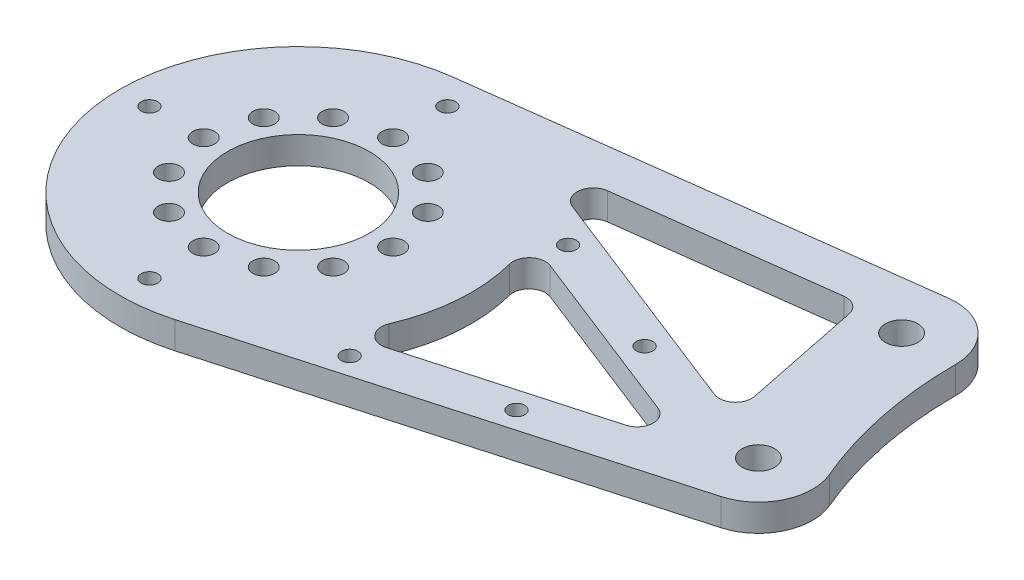
from build123d import *

# Parameters (mm, degrees)
SKETCH_1_R          = 33
SKETCH_1_R_2        = 13.1
SKETCH_1_R_3        = 2.025
SKETCH_1_R_4        = 10
SKETCH_1_R_5        = 3
EXTRUDE_1_DEPTH     = 5
CUT_EXTRUDE_3_DEPTH = 10
FILLET_2_R          = 3
SKETCH_5_R          = 1.525
CUT_EXTRUDE_4_DEPTH = 20


with BuildPart() as part:
    # 草图1 → 凸台-拉伸1 (new body)
    # profile 1 of 4: a face of its own
    with BuildSketch(Plane(origin=(0, 0, 0), x_dir=(1, 0, 0), z_dir=(0, 1, 0))):
        with BuildLine():
            ThreePointArc((33, 0), (26.302762101, -19.928991592), (8.929411765, -31.768940894))
            Line((8.929411765, -31.768940894), (87.705882353, -9.626951786))
            ThreePointArc((87.705882353, -9.626951786), (75.985476525, 4.328783491), (94.205048973, 3.907310252))
            ThreePointArc((94.205048973, 3.907310252), (89.748559809, 18.25955029), (88.242912543, 33.212145922))
            ThreePointArc((88.242912543, 33.212145922), (71.63638997, 25.705225149), (76.972140647, 43.13107423))
            Line((76.972140647, 43.13107423), (-4.193547259, 32.732463418))
            ThreePointArc((-4.193547259, 32.732463418), (21.801524493, 24.772838549), (33, 0))
        make_face()
    # profile 2 of 4: a face of its own
    with BuildSketch(Plane(origin=(0, 0, 0), x_dir=(1, 0, 0), z_dir=(0, 1, 0))):
        Circle(SKETCH_1_R)
        with Locations(Location((0, 0, 0), (0, 0, 270))):
            Circle(SKETCH_1_R_2, mode=Mode.SUBTRACT)
        with Locations(Location((0, 17.5, 0), (0, 0, 270))):
            Circle(SKETCH_1_R_3, mode=Mode.SUBTRACT)
        with Locations(Location((8.75, 15.155444566, 0), (0, 0, 270))):
            Circle(SKETCH_1_R_3, mode=Mode.SUBTRACT)
        with Locations(Location((15.155444566, 8.75, 0), (0, 0, 270))):
            Circle(SKETCH_1_R_3, mode=Mode.SUBTRACT)
        with Locations(Location((17.5, 0, 0), (0, 0, 270))):
            Circle(SKETCH_1_R_3, mode=Mode.SUBTRACT)
        with Locations(Location((15.155444566, -8.75, 0), (0, 0, 270))):
            Circle(SKETCH_1_R_3, mode=Mode.SUBTRACT)
        with Locations(Location((8.75, -15.155444566, 0), (0, 0, 270))):
            Circle(SKETCH_1_R_3, mode=Mode.SUBTRACT)
        with Locations(Location((0, -17.5, 0), (0, 0, 270))):
            Circle(SKETCH_1_R_3, mode=Mode.SUBTRACT)
        with Locations(Location((-8.75, -15.155444566, 0), (0, 0, 270))):
            Circle(SKETCH_1_R_3, mode=Mode.SUBTRACT)
        with Locations(Location((-15.155444566, -8.75, 0), (0, 0, 270))):
            Circle(SKETCH_1_R_3, mode=Mode.SUBTRACT)
        with Locations(Location((-17.5, 0, 0), (0, 0, 270))):
            Circle(SKETCH_1_R_3, mode=Mode.SUBTRACT)
        with Locations(Location((-15.155444566, 8.75, 0), (0, 0, 270))):
            Circle(SKETCH_1_R_3, mode=Mode.SUBTRACT)
        with Locations(Location((-8.75, 15.155444566, 0), (0, 0, 270))):
            Circle(SKETCH_1_R_3, mode=Mode.SUBTRACT)
    # profile 3 of 4: a face of its own
    with BuildSketch(Plane(origin=(0, 0, 0), x_dir=(1, 0, 0), z_dir=(0, 1, 0))):
        with Locations((85, 0)):
            Circle(SKETCH_1_R_4)
        with Locations(Location((85, 0, 0), (0, 0, 270))):
            Circle(SKETCH_1_R_5, mode=Mode.SUBTRACT)
    # profile 4 of 4: a face of its own
    with BuildSketch(Plane(origin=(0, 0, 0), x_dir=(1, 0, 0), z_dir=(0, 1, 0))):
        with Locations((78.242912543, 33.212145922)):
            Circle(SKETCH_1_R_4)
        with Locations(Location((78.242912543, 33.212145922, 0), (0, 0, 270))):
            Circle(SKETCH_1_R_5, mode=Mode.SUBTRACT)
    extrude(amount=EXTRUDE_1_DEPTH)

    # 草图4 → 切除-拉伸3 (cut)
    with BuildSketch(Plane.XZ):
        with BuildLine():
            Line((76.108728609, 4.576602785), (25.994527014, 18.662383699))
            ThreePointArc((25.994527014, 18.662383699), (30.461655113, 9.802426627), (32, 0))
            ThreePointArc((32, 0), (31.185942012, -7.171960739), (28.785186198, -13.979021981))
            Line((28.785186198, -13.979021981), (76.108728609, 4.576602785))
        make_face()
        Polygon((69.770383541, -34.143027562), (16.636114037, -27.335685646), (75.881597407, -4.105451761), align=None)
    extrude(amount=-CUT_EXTRUDE_3_DEPTH, mode=Mode.SUBTRACT)

    # 圆角2
    fillet_2_edges = [part.edges().sort_by_distance(p)[0] for p in [
        (69.770383541, 2.5, -34.143027562),
        (16.636114037, 2.5, -27.335685646),
        (75.881597407, 2.5, -4.105451761),
        (28.785186198, 2.5, -13.979021981),
        (25.994527014, 2.5, 18.662383699),
        (76.108728609, 2.5, 4.576602785),
    ]]
    fillet(fillet_2_edges, radius=FILLET_2_R)

    # 草图5 → 切除-拉伸4 (cut)
    with BuildSketch(Plane(origin=(0, 5, 0), x_dir=(1, 0, 0), z_dir=(0, 1, 0))):
        with Locations(Location((-27.522163408, 0, 0), (0, 0, 270))):
            Circle(SKETCH_5_R)
        with Locations(Location((0, 27.522163408, 0), (0, 0, 270))):
            Circle(SKETCH_5_R)
        with Locations(Location((0, -27.522163408, 0), (0, 0, 270))):
            Circle(SKETCH_5_R)
        with Locations(Location((30.901702525, -21.438107622, 0), (0, 0, 270))):
            Circle(SKETCH_5_R)
        with Locations(Location((54.969081991, -14.673401739, 0), (0, 0, 270))):
            Circle(SKETCH_5_R)
        with Locations(Location((33.321534862, 16.496811603, 0), (0, 0, 270))):
            Circle(SKETCH_5_R)
        with Locations(Location((56.596303964, 7.370743267, 0), (0, 0, 270))):
            Circle(SKETCH_5_R)
    extrude(amount=-CUT_EXTRUDE_4_DEPTH, mode=Mode.SUBTRACT)


solid = part.part
